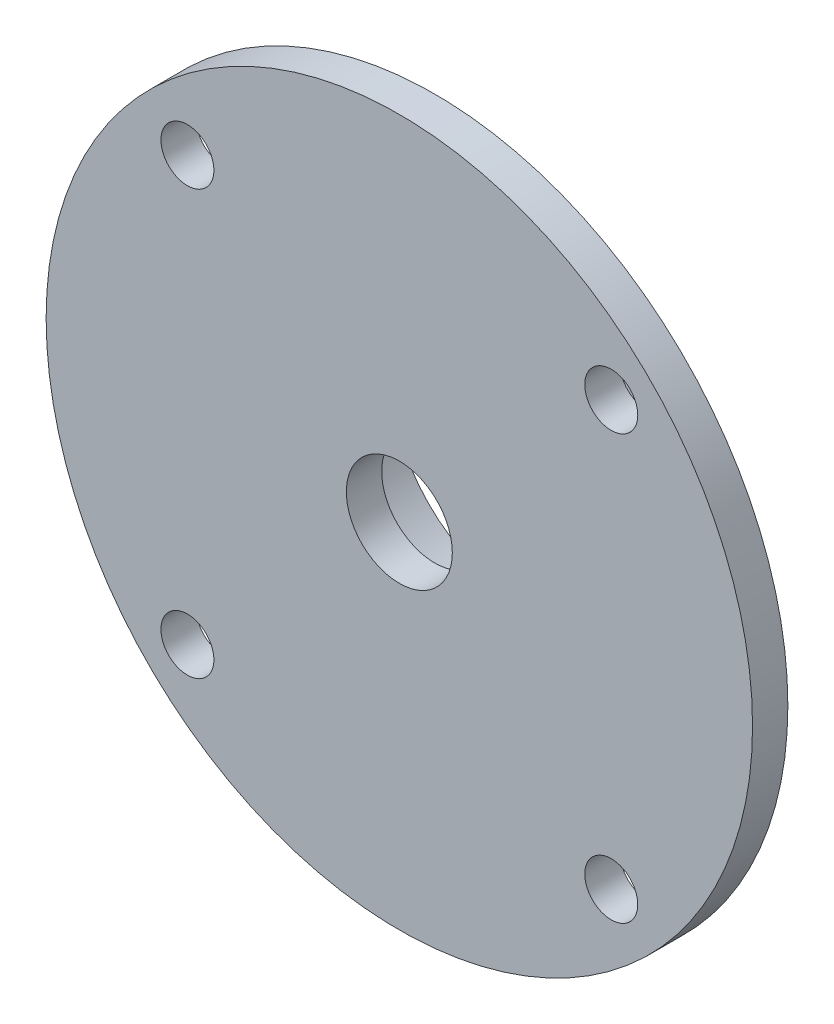
from build123d import *

# Parameters (mm, degrees)
SKETCH_1_R      = 20
SKETCH_1_R_2    = 1.5
SKETCH_1_R_3    = 3
EXTRUDE_1_DEPTH = 2
SKETCH_3_R      = 11
SKETCH_3_R_2    = 7.5
EXTRUDE_2_DEPTH = 5


with BuildPart() as part:
    # 草图1 → 凸台-拉伸1 (new body)
    with BuildSketch(Plane.XY):
        Circle(SKETCH_1_R)
        with Locations((-12, 12)):
            Circle(SKETCH_1_R_2, mode=Mode.SUBTRACT)
        with Locations((12, 12)):
            Circle(SKETCH_1_R_2, mode=Mode.SUBTRACT)
        with Locations((12, -12)):
            Circle(SKETCH_1_R_2, mode=Mode.SUBTRACT)
        with Locations((-12, -12)):
            Circle(SKETCH_1_R_2, mode=Mode.SUBTRACT)
        Circle(SKETCH_1_R_3, mode=Mode.SUBTRACT)
    extrude(amount=EXTRUDE_1_DEPTH)

    # 草图3 → 凸台-拉伸2 (add)
    with BuildSketch(Plane(origin=(0, 0, 0), x_dir=(-1, 0, 0), z_dir=(0, 0, -1))):
        with Locations(Location((0, 0, 0), (0, 0, 180))):
            Circle(SKETCH_3_R)
        Circle(SKETCH_3_R_2, mode=Mode.SUBTRACT)
    extrude(amount=EXTRUDE_2_DEPTH)


solid = part.part
